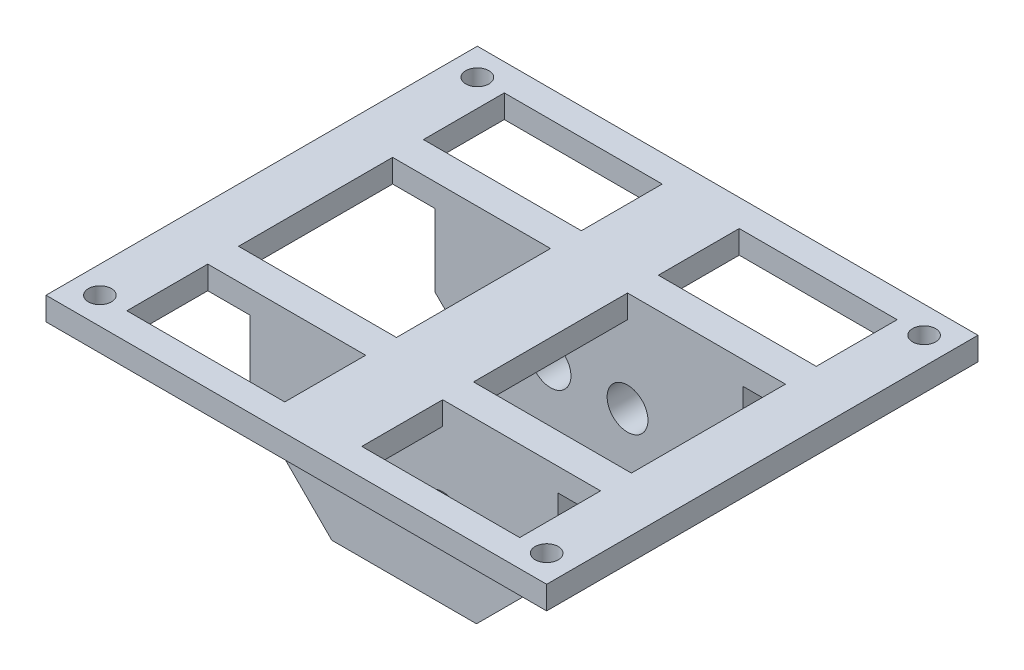
from build123d import *

# Parameters (mm, degrees)
SKETCH1_W           = 65
SKETCH1_H           = 56
SKETCH1_R           = 1.5
SKETCH1_W_2         = 20.5
SKETCH1_H_2         = 20
SKETCH1_H_3         = 10.5
BOSS_EXTRUDE1_DEPTH = 3
SKETCH5_W           = 40
SKETCH5_H           = 4
BOSS_EXTRUDE4_DEPTH = 20
CUT_EXTRUDE1_REACH  = 81.931
SKETCH6_R           = 2.65


with BuildPart() as part:
    # Sketch1 → Boss-Extrude1 (new body)
    with BuildSketch(Plane(origin=(0, 0, 0), x_dir=(1, 0, 0), z_dir=(0, 1, 0))):
        with Locations((32.5, 28)):
            Rectangle(SKETCH1_W, SKETCH1_H)
        with Locations(Location((3.5, 52.5, 0), (0, 0, 270))):
            Circle(SKETCH1_R, mode=Mode.SUBTRACT)
        with Locations(Location((61.5, 52.5, 0), (0, 0, 270))):
            Circle(SKETCH1_R, mode=Mode.SUBTRACT)
        with Locations(Location((61.5, 3.5, 0), (0, 0, 270))):
            Circle(SKETCH1_R, mode=Mode.SUBTRACT)
        with Locations(Location((3.5, 3.5, 0), (0, 0, 270))):
            Circle(SKETCH1_R, mode=Mode.SUBTRACT)
        with Locations((17.25, 28)):
            Rectangle(SKETCH1_W_2, SKETCH1_H_2, mode=Mode.SUBTRACT)
        with Locations((47.75, 28)):
            Rectangle(SKETCH1_W_2, SKETCH1_H_2, mode=Mode.SUBTRACT)
        with Locations((17.25, 47.25)):
            Rectangle(SKETCH1_W_2, SKETCH1_H_3, mode=Mode.SUBTRACT)
        with Locations((47.75, 47.25)):
            Rectangle(SKETCH1_W_2, SKETCH1_H_3, mode=Mode.SUBTRACT)
        with Locations((47.75, 8.75)):
            Rectangle(SKETCH1_W_2, SKETCH1_H_3, mode=Mode.SUBTRACT)
        with Locations((17.25, 8.75)):
            Rectangle(SKETCH1_W_2, SKETCH1_H_3, mode=Mode.SUBTRACT)
    extrude(amount=BOSS_EXTRUDE1_DEPTH)

    # Sketch5 → Boss-Extrude4 (add)
    with BuildSketch(Plane.XZ):
        with Locations((32.5, -16)):
            Rectangle(SKETCH5_W, SKETCH5_H)
        with Locations((32.5, -40)):
            Rectangle(SKETCH5_W, SKETCH5_H)
    extrude(amount=BOSS_EXTRUDE4_DEPTH)

    # Cut-Extrude1: up to this face of the body (flat: up to its plane)
    cut_extrude1_end = Plane(part.part.faces().sort_by_distance((32.5, -8.467497291, -42))[0])
    # Sketch6 → Cut-Extrude1 (cut, up to the picked face)
    with BuildSketch(Plane.XY.offset(-14), mode=Mode.PRIVATE) as cut_extrude1_sk1:
        with Locations((27.5, -10)):
            Circle(SKETCH6_R)
    cut_extrude1_tool1 = split(extrude(cut_extrude1_sk1.sketch, amount=-CUT_EXTRUDE1_REACH, mode=Mode.PRIVATE), bisect_by=cut_extrude1_end, keep=Keep.BOTH, mode=Mode.PRIVATE)
    # Sketch6 → Cut-Extrude1 (cut, up to the picked face)
    with BuildSketch(Plane.XY.offset(-14), mode=Mode.PRIVATE) as cut_extrude1_sk2:
        with Locations((37.5, -10)):
            Circle(SKETCH6_R)
    cut_extrude1_tool2 = split(extrude(cut_extrude1_sk2.sketch, amount=-CUT_EXTRUDE1_REACH, mode=Mode.PRIVATE), bisect_by=cut_extrude1_end, keep=Keep.BOTH, mode=Mode.PRIVATE)
    # Sketch6 → Cut-Extrude1 (cut, up to the picked face)
    with BuildSketch(Plane.XY.offset(-14), mode=Mode.PRIVATE) as cut_extrude1_sk3:
        Polygon((12.5, -9.393398282), (12.5, -20), (23.106601718, -20), align=None)
    cut_extrude1_tool3 = split(extrude(cut_extrude1_sk3.sketch, amount=-CUT_EXTRUDE1_REACH, mode=Mode.PRIVATE), bisect_by=cut_extrude1_end, keep=Keep.BOTH, mode=Mode.PRIVATE)
    # Sketch6 → Cut-Extrude1 (cut, up to the picked face)
    with BuildSketch(Plane.XY.offset(-14), mode=Mode.PRIVATE) as cut_extrude1_sk4:
        Polygon((41.893398282, -20), (52.5, -20), (52.5, -9.393398282), align=None)
    cut_extrude1_tool4 = split(extrude(cut_extrude1_sk4.sketch, amount=-CUT_EXTRUDE1_REACH, mode=Mode.PRIVATE), bisect_by=cut_extrude1_end, keep=Keep.BOTH, mode=Mode.PRIVATE)
    add(cut_extrude1_tool1.solids().sort_by(Axis((27.5, -10, -14), (0, 0, -1)))[0], mode=Mode.SUBTRACT)
    add(cut_extrude1_tool2.solids().sort_by(Axis((37.5, -10, -14), (0, 0, -1)))[0], mode=Mode.SUBTRACT)
    add(cut_extrude1_tool3.solids().sort_by(Axis((16.035534, -16.464466, -14), (0, 0, -1)))[0], mode=Mode.SUBTRACT)
    add(cut_extrude1_tool4.solids().sort_by(Axis((48.964466, -16.464466, -14), (0, 0, -1)))[0], mode=Mode.SUBTRACT)


solid = part.part
